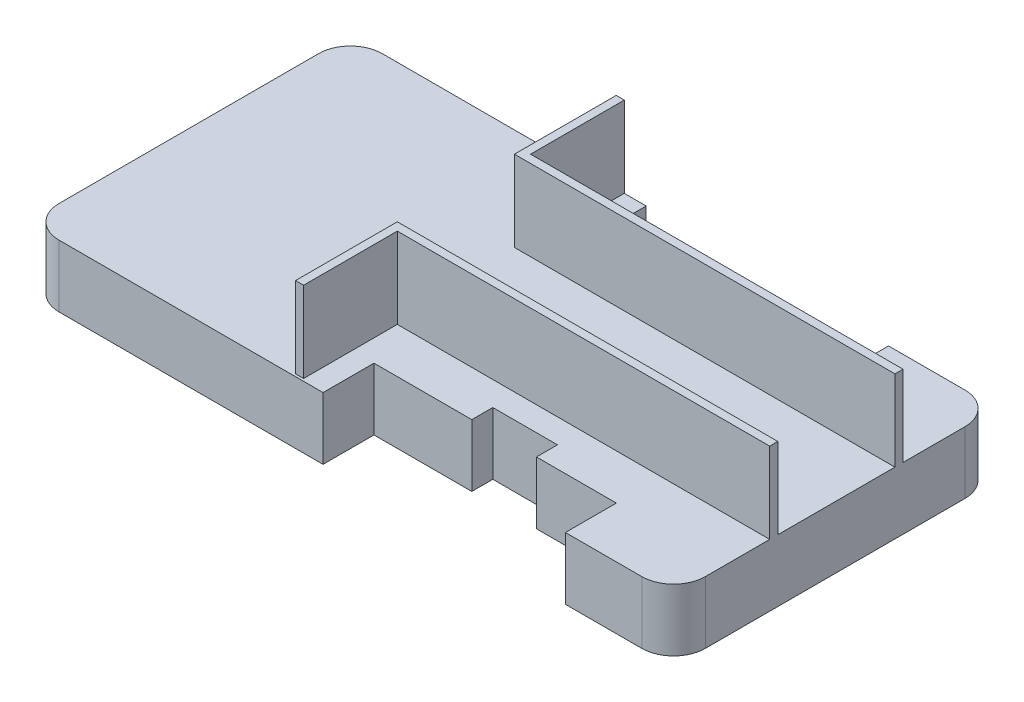
from build123d import *

# Parameters (mm, degrees)
SKETCH2_W           = 203.2
SKETCH2_H           = 101.6
BOSS_EXTRUDE1_DEPTH = 19.558
SKETCH3_W           = 76.2
SKETCH3_H           = 5.08
CUT_EXTRUDE2_DEPTH  = 19.558
FILLET1_R           = 10
FILLET2_R           = 10
FILLET3_R           = 10
FILLET4_R           = 10
EXTRUDE_THIN5_DEPTH = 25.4


with BuildPart() as part:
    # Sketch2 → Boss-Extrude1 (new body)
    with BuildSketch(Plane(origin=(-97.482495003, 0, 34.735141898), x_dir=(1, 0, 0), z_dir=(0, 1, 0))):
        with Locations((-19.545959724, 34.347881976)):
            Rectangle(SKETCH2_W, SKETCH2_H)
    extrude(amount=BOSS_EXTRUDE1_DEPTH)

    # Sketch3 → Cut-Extrude2 (cut)
    with BuildSketch(Plane(origin=(-97.482495003, 19.558, 34.735141898), x_dir=(1, 0, 0), z_dir=(0, 1, 0))):
        Polygon((48.044591515, 85.147881976), (-28.155408485, 85.147881976), (-28.155408485, 69.907881976), (-15.015206922, 69.907881976), (2.604442641, 69.907881976), (2.604442641, 63.303881976), (22.924442641, 63.303881976), (22.924442641, 69.907881976), (48.044591515, 69.907881976), align=None)
        with Locations((9.944591515, 87.687881976)):
            Rectangle(SKETCH3_W, SKETCH3_H)
    cut_extrude2 = extrude(amount=-CUT_EXTRUDE2_DEPTH, mode=Mode.SUBTRACT)

    # Mirror4: Cut-Extrude2 across plane
    add(cut_extrude2.mirror(Plane.XY), mode=Mode.SUBTRACT)

    # Fillet1
    fillet1_edges = [part.edges().sort_by_distance(p)[0] for p in [
        (-15.428454726, 9.779, 51.187259921),
    ]]
    fillet(fillet1_edges, radius=FILLET1_R)

    # Fillet2
    fillet2_edges = [part.edges().sort_by_distance(p)[0] for p in [
        (-218.628454726, 9.779, -50.412740079),
    ]]
    fillet(fillet2_edges, radius=FILLET2_R)

    # Fillet3
    fillet3_edges = [part.edges().sort_by_distance(p)[0] for p in [
        (-218.628454726, 9.779, 51.187259921),
    ]]
    fillet(fillet3_edges, radius=FILLET3_R)

    # Fillet4
    fillet4_edges = [part.edges().sort_by_distance(p)[0] for p in [
        (-15.428454726, 9.779, -50.412740079),
    ]]
    fillet(fillet4_edges, radius=FILLET4_R)

    # Sketch7 → Extrude-Thin5 (add)
    with BuildSketch(Plane(origin=(0, 19.558, 0), x_dir=(1, 0, 0), z_dir=(0, 1, 0))):
        Polygon((-132.522454726, 50.412740079), (-132.522454726, 20.948740079), (-15.428454726, 20.948740079), (-15.428454726, 18.408740079), (-135.062454726, 18.408740079), (-135.062454726, 50.412740079), align=None)
    extrude_thin5 = extrude(amount=EXTRUDE_THIN5_DEPTH)

    # Mirror5: Extrude-Thin5 across plane
    add(extrude_thin5.mirror(Plane.XY))


solid = part.part
